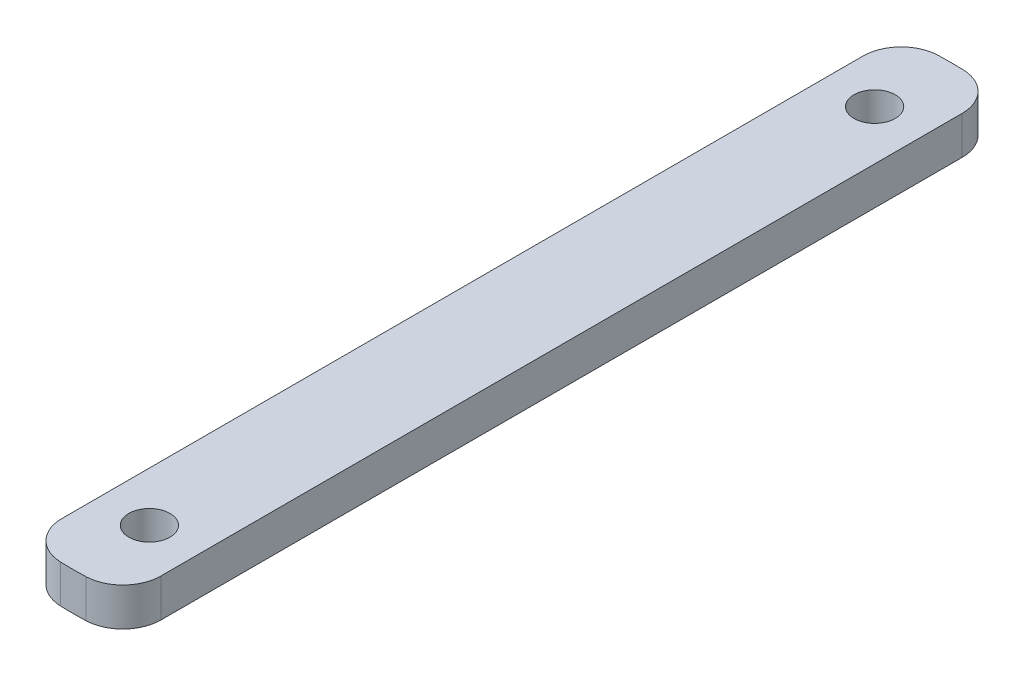
from build123d import *

# Parameters (mm, degrees)
SKETCH1_R           = 73.025
SKETCH1_R_2         = 3.429
BOSS_EXTRUDE1_DEPTH = 6.35
SKETCH2_W           = 64.77
SKETCH2_H           = 146.05
CUT_EXTRUDE1_DEPTH  = 104.467984179
FILLET1_R           = 6.35


with BuildPart() as part:
    # Sketch1 → Boss-Extrude1 (new body)
    with BuildSketch(Plane(origin=(0, 0, 0), x_dir=(1, 0, 0), z_dir=(0, 1, 0))):
        with Locations(Location((0, 0, 0), (0, 0, 270))):
            Circle(SKETCH1_R)
        with Locations(Location((0, 60.325, 0), (0, 0, 270))):
            Circle(SKETCH1_R_2, mode=Mode.SUBTRACT)
        with Locations(Location((0, -60.325, 0), (0, 0, 90))):
            Circle(SKETCH1_R_2, mode=Mode.SUBTRACT)
    extrude(amount=BOSS_EXTRUDE1_DEPTH)

    # Sketch2 → Cut-Extrude1 (cut, through all)
    with BuildSketch(Plane(origin=(0, 6.35, 0), x_dir=(1, 0, 0), z_dir=(0, 1, 0))):
        with Locations((40.64, 0)):
            Rectangle(SKETCH2_W, SKETCH2_H)
        with Locations((-40.64, 0)):
            Rectangle(SKETCH2_W, SKETCH2_H)
    extrude(amount=-CUT_EXTRUDE1_DEPTH, mode=Mode.SUBTRACT)

    # Fillet1
    fillet1_edges = [part.edges().sort_by_distance(p)[0] for p in [
        (-8.255, 3.175, -72.556912834),
        (-8.255, 3.175, 72.556912834),
        (8.255, 3.175, 72.556912834),
        (8.255, 3.175, -72.556912834),
    ]]
    fillet(fillet1_edges, radius=FILLET1_R)


solid = part.part
